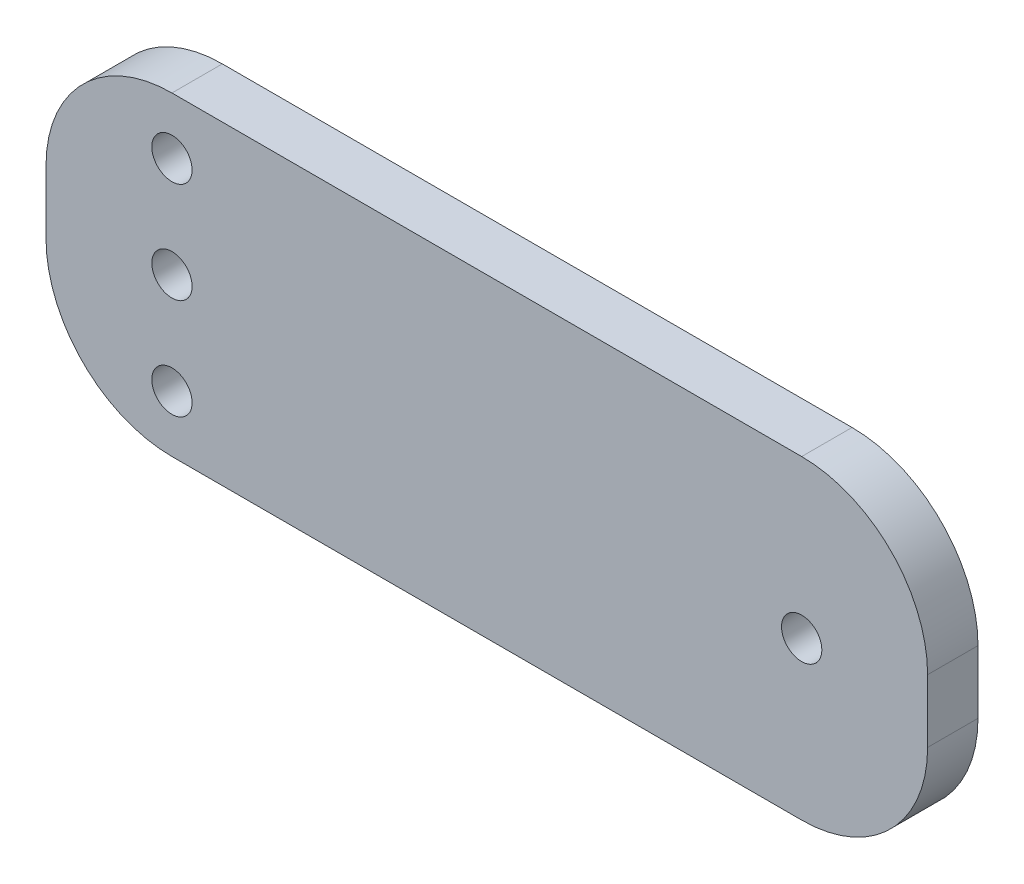
from build123d import *

# Parameters (mm, degrees)
SKETCH_1_W      = 70
SKETCH_1_H      = 25
SKETCH_1_R      = 1.6
EXTRUDE_1_DEPTH = 4
FILLET_1_R      = 10


with BuildPart() as part:
    # 草图1 → 凸台-拉伸1 (new body)
    with BuildSketch(Plane.XY):
        Rectangle(SKETCH_1_W, SKETCH_1_H)
        with Locations((-25, 0)):
            Circle(SKETCH_1_R, mode=Mode.SUBTRACT)
        with Locations((25, 0)):
            Circle(SKETCH_1_R, mode=Mode.SUBTRACT)
        with Locations((-25, 8)):
            Circle(SKETCH_1_R, mode=Mode.SUBTRACT)
        with Locations((-25, -8)):
            Circle(SKETCH_1_R, mode=Mode.SUBTRACT)
    extrude(amount=EXTRUDE_1_DEPTH)

    # 圆角1
    fillet_1_edges = [part.edges().sort_by_distance(p)[0] for p in [
        (35, -12.5, 2),
        (-35, -12.5, 2),
        (-35, 12.5, 2),
        (35, 12.5, 2),
    ]]
    fillet(fillet_1_edges, radius=FILLET_1_R)


solid = part.part
